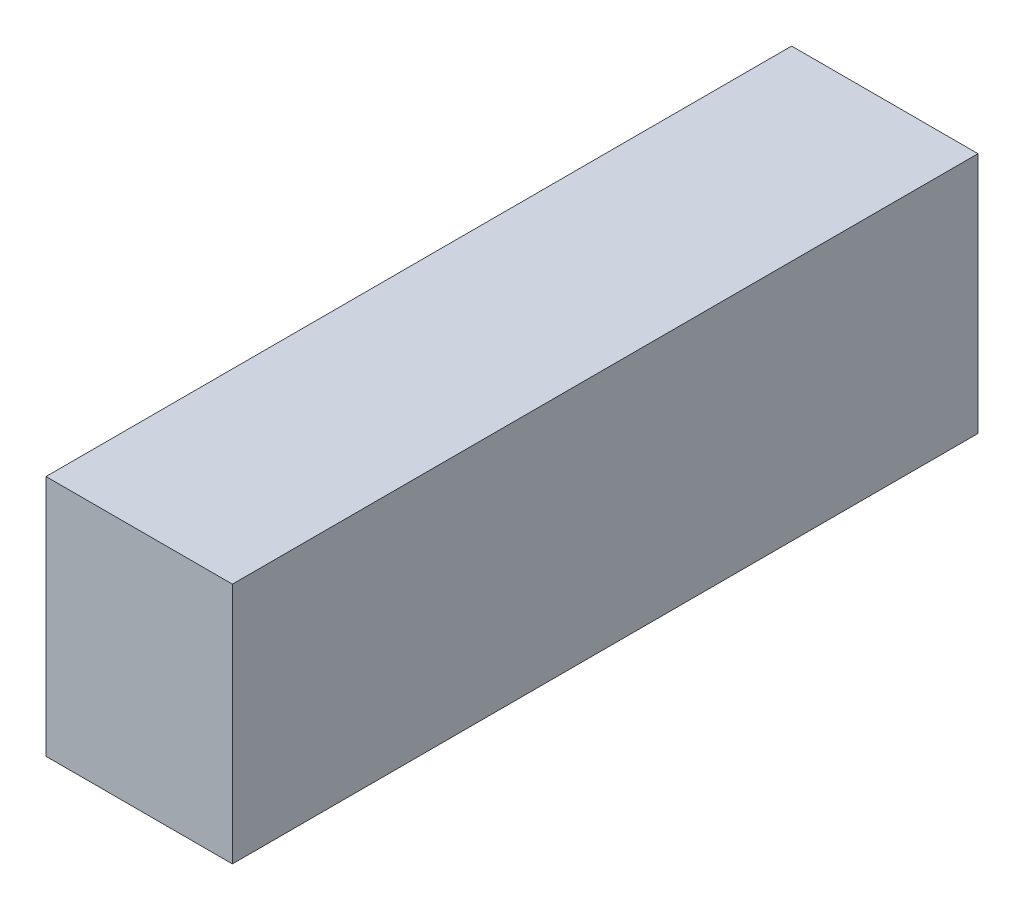
from build123d import *

# Parameters (mm, degrees)
SKETCH1_W           = 40
SKETCH1_H           = 13
BOSS_EXTRUDE1_DEPTH = 10


with BuildPart() as part:
    # Sketch1 → Boss-Extrude1 (new body)
    with BuildSketch(Plane(origin=(0, 0, 0), x_dir=(0, 0, -1), z_dir=(1, 0, 0))):
        with Locations((20, 6.5)):
            Rectangle(SKETCH1_W, SKETCH1_H)
    extrude(amount=-BOSS_EXTRUDE1_DEPTH)


solid = part.part
